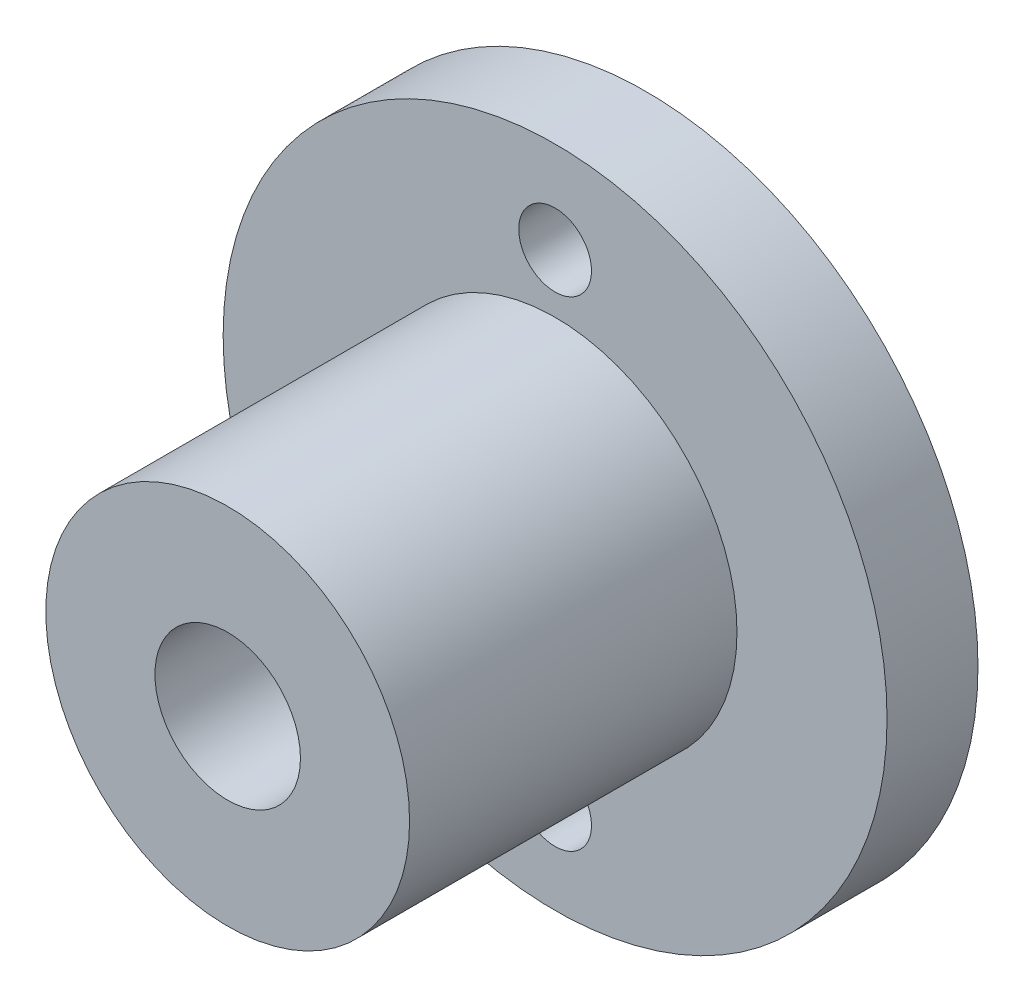
from build123d import *

# Parameters (mm, degrees)
CROQUIS1_R              = 18.25
CROQUIS1_R_2            = 2
SALIENTE_EXTRUIR2_DEPTH = 5
CROQUIS2_R              = 10
SALIENTE_EXTRUIR4_DEPTH = 18
CROQUIS3_R              = 4
CORTAR_EXTRUIR1_DEPTH   = 23


with BuildPart() as part:
    # Croquis1 → Saliente-Extruir2 (new body)
    with BuildSketch(Plane.XY):
        Circle(CROQUIS1_R)
        with Locations((0, 13.2)):
            Circle(CROQUIS1_R_2, mode=Mode.SUBTRACT)
        with Locations(Location((0, -13.2, 0), (0, 0, 180))):
            Circle(CROQUIS1_R_2, mode=Mode.SUBTRACT)
    extrude(amount=-SALIENTE_EXTRUIR2_DEPTH)

    # Croquis2 → Saliente-Extruir4 (add)
    with BuildSketch(Plane.XY):
        Circle(CROQUIS2_R)
    extrude(amount=SALIENTE_EXTRUIR4_DEPTH)

    # Croquis3 → Cortar-Extruir1 (cut)
    with BuildSketch(Plane.XY.offset(18)):
        Circle(CROQUIS3_R)
    extrude(amount=-CORTAR_EXTRUIR1_DEPTH, mode=Mode.SUBTRACT)


solid = part.part
